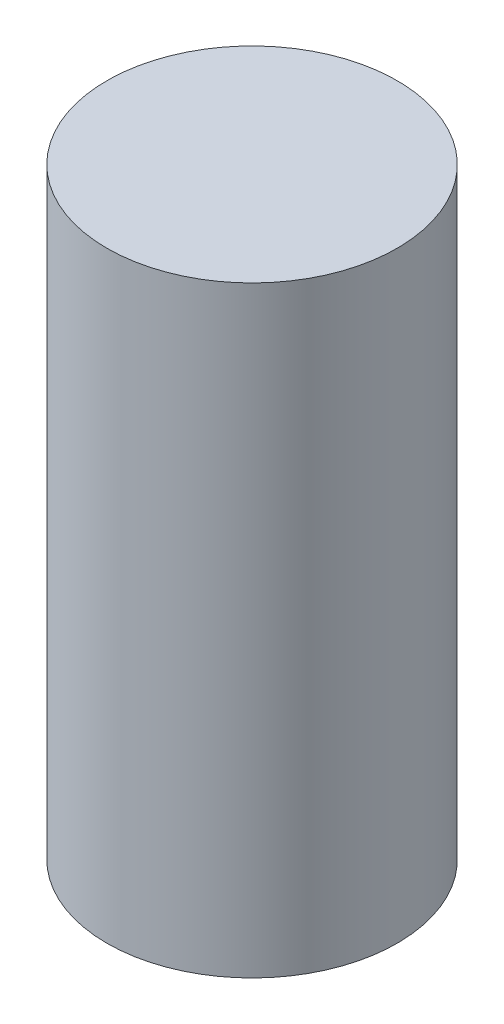
from build123d import *

# Parameters (mm, degrees)
SKETCH1_R           = 3
BOSS_EXTRUDE1_DEPTH = 12.44


with BuildPart() as part:
    # Sketch1 → Boss-Extrude1 (new body)
    with BuildSketch(Plane(origin=(0, 0, 0), x_dir=(1, 0, 0), z_dir=(0, 1, 0))):
        with Locations(Location((0, 0, 0), (0, 0, 270))):
            Circle(SKETCH1_R)
    extrude(amount=BOSS_EXTRUDE1_DEPTH)


solid = part.part
